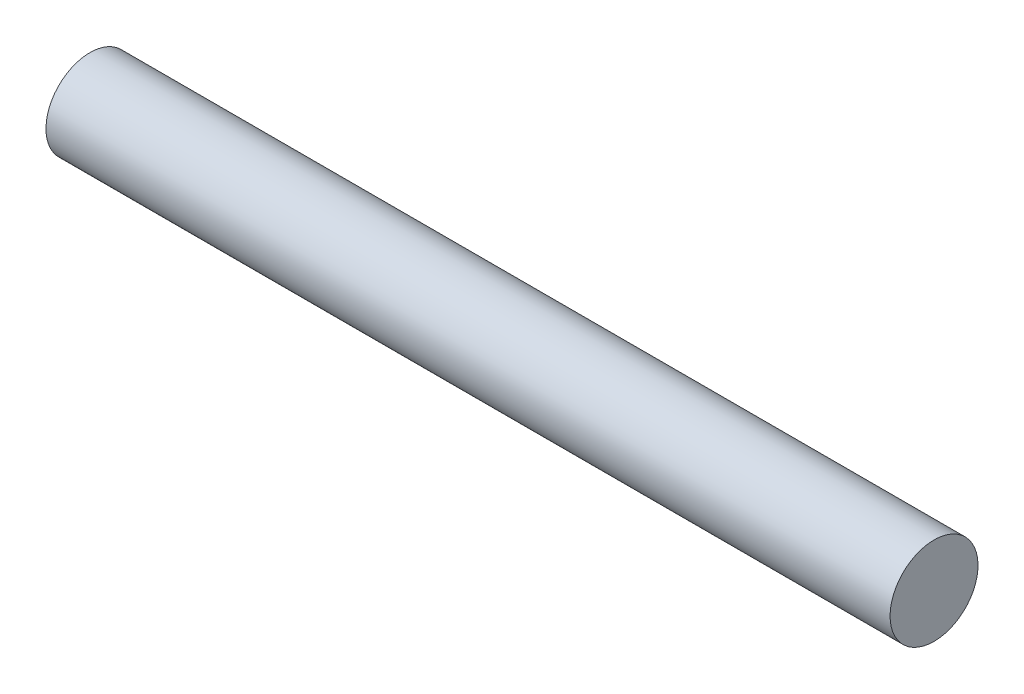
from build123d import *

# Parameters (mm, degrees)
SKETCH2_W = 96
SKETCH2_H = 5


with BuildPart() as part:
    # Sketch2 → Revolve1 (revolve)
    with BuildSketch(Plane.XY):
        with Locations((-37.846938776, 0.68877551)):
            Rectangle(SKETCH2_W, SKETCH2_H)
    revolve(axis=Axis((-85.846938776, 3.18877551, 0), (1, 0, 0)))


solid = part.part
